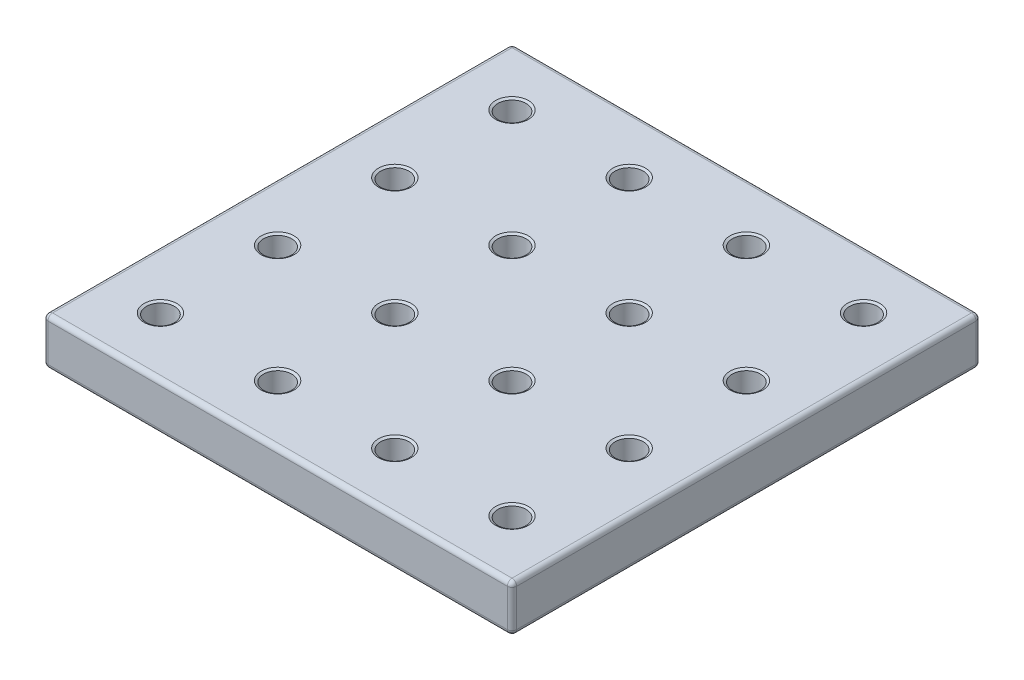
from build123d import *
from OCP.BRepFilletAPI import BRepFilletAPI_MakeChamfer

# Parameters (mm, degrees)
BASE_SKETCH_W          = 50
BASE_SKETCH_H          = 50
BASE_EXTRUDE_DEPTH     = 5
CIRCLES_SKETCH_R       = 1.5
CIRCLE_CUTS_DEPTH      = 5
EDGE_FILLET_R          = 0.5
CIRCULAR_CHAMFER_SIZE  = 0.25
CIRCULAR_CHAMFER_SIZE2 = 0.144337567


with BuildPart() as part:
    # Base Sketch → Base Extrude (new body)
    with BuildSketch(Plane(origin=(0, 0, 0), x_dir=(1, 0, 0), z_dir=(0, 1, 0))):
        Rectangle(BASE_SKETCH_W, BASE_SKETCH_H)
    extrude(amount=BASE_EXTRUDE_DEPTH)

    # Circles Sketch → Circle Cuts (cut)
    with BuildSketch(Plane(origin=(0, 5, 0), x_dir=(1, 0, 0), z_dir=(0, 1, 0))):
        with Locations(Location((-18.75, 18.75, 0), (0, 0, 270))):
            Circle(CIRCLES_SKETCH_R)
        with Locations(Location((-6.25, 18.75, 0), (0, 0, 270))):
            Circle(CIRCLES_SKETCH_R)
        with Locations(Location((6.25, 18.75, 0), (0, 0, 270))):
            Circle(CIRCLES_SKETCH_R)
        with Locations(Location((18.75, 18.75, 0), (0, 0, 270))):
            Circle(CIRCLES_SKETCH_R)
        with Locations(Location((-18.75, 6.25, 0), (0, 0, 270))):
            Circle(CIRCLES_SKETCH_R)
        with Locations(Location((-6.25, 6.25, 0), (0, 0, 270))):
            Circle(CIRCLES_SKETCH_R)
        with Locations(Location((6.25, 6.25, 0), (0, 0, 270))):
            Circle(CIRCLES_SKETCH_R)
        with Locations(Location((18.75, 6.25, 0), (0, 0, 270))):
            Circle(CIRCLES_SKETCH_R)
        with Locations(Location((-18.75, -6.25, 0), (0, 0, 270))):
            Circle(CIRCLES_SKETCH_R)
        with Locations(Location((-6.25, -6.25, 0), (0, 0, 270))):
            Circle(CIRCLES_SKETCH_R)
        with Locations(Location((6.25, -6.25, 0), (0, 0, 270))):
            Circle(CIRCLES_SKETCH_R)
        with Locations(Location((18.75, -6.25, 0), (0, 0, 270))):
            Circle(CIRCLES_SKETCH_R)
        with Locations(Location((-18.75, -18.75, 0), (0, 0, 270))):
            Circle(CIRCLES_SKETCH_R)
        with Locations(Location((-6.25, -18.75, 0), (0, 0, 270))):
            Circle(CIRCLES_SKETCH_R)
        with Locations(Location((6.25, -18.75, 0), (0, 0, 270))):
            Circle(CIRCLES_SKETCH_R)
        with Locations(Location((18.75, -18.75, 0), (0, 0, 270))):
            Circle(CIRCLES_SKETCH_R)
    extrude(amount=-CIRCLE_CUTS_DEPTH, mode=Mode.SUBTRACT)

    # Edge Fillet
    edge_fillet_edges = [part.edges().sort_by_distance(p)[0] for p in [
        (-25, 5, 0),
        (0, 5, 25),
        (25, 5, 0),
        (0, 0, 25),
        (-25, 0, 0),
        (0, 0, -25),
        (25, 0, 0),
        (25, 2.5, 25),
        (-25, 2.5, 25),
        (-25, 2.5, -25),
        (25, 2.5, -25),
        (0, 5, -25),
    ]]
    fillet(edge_fillet_edges, radius=EDGE_FILLET_R)

    # Circular Chamfer: one chamfer whose edges measure the first distance from different faces: ONE call of the kernel's chamfer builder (chamfer() names one face for all edges)
    circular_chamfer_edges_1 = [part.edges().sort_by_distance(p)[0] for p in [
        (18.75, 0, -20.25),
    ]]
    circular_chamfer_side_1 = [part.faces().sort_by_distance(p)[0] for p in [
        (18.75, 2.5, -20.25),
    ]]
    circular_chamfer_edges_2 = [part.edges().sort_by_distance(p)[0] for p in [
        (18.75, 5, -20.25),
        (6.25, 5, -20.25),
        (6.25, 5, -7.75),
        (6.25, 5, 4.75),
        (-6.25, 5, 4.75),
        (-6.25, 5, -7.75),
        (-6.25, 5, -20.25),
        (-18.75, 5, -20.25),
        (-18.75, 5, 17.25),
        (-6.25, 5, 17.25),
        (6.25, 5, 17.25),
        (18.75, 5, 4.75),
        (18.75, 5, 17.25),
        (-18.75, 5, 4.75),
        (-18.75, 5, -7.75),
        (18.75, 5, -7.75),
    ]]
    circular_chamfer_side_2 = [part.faces().sort_by_distance(p)[0] for p in [
        (0, 5, 0),
    ]]
    circular_chamfer_edges_3 = [part.edges().sort_by_distance(p)[0] for p in [
        (6.25, 0, -20.25),
    ]]
    circular_chamfer_side_3 = [part.faces().sort_by_distance(p)[0] for p in [
        (6.25, 2.5, -20.25),
    ]]
    circular_chamfer_edges_4 = [part.edges().sort_by_distance(p)[0] for p in [
        (6.25, 0, -7.75),
    ]]
    circular_chamfer_side_4 = [part.faces().sort_by_distance(p)[0] for p in [
        (6.25, 2.5, -7.75),
    ]]
    circular_chamfer_edges_5 = [part.edges().sort_by_distance(p)[0] for p in [
        (6.25, 0, 4.75),
    ]]
    circular_chamfer_side_5 = [part.faces().sort_by_distance(p)[0] for p in [
        (6.25, 2.5, 4.75),
    ]]
    circular_chamfer_edges_6 = [part.edges().sort_by_distance(p)[0] for p in [
        (-6.25, 0, 4.75),
    ]]
    circular_chamfer_side_6 = [part.faces().sort_by_distance(p)[0] for p in [
        (-6.25, 2.5, 4.75),
    ]]
    circular_chamfer_edges_7 = [part.edges().sort_by_distance(p)[0] for p in [
        (-6.25, 0, -7.75),
    ]]
    circular_chamfer_side_7 = [part.faces().sort_by_distance(p)[0] for p in [
        (-6.25, 2.5, -7.75),
    ]]
    circular_chamfer_edges_8 = [part.edges().sort_by_distance(p)[0] for p in [
        (-6.25, 0, -20.25),
    ]]
    circular_chamfer_side_8 = [part.faces().sort_by_distance(p)[0] for p in [
        (-6.25, 2.5, -20.25),
    ]]
    circular_chamfer_edges_9 = [part.edges().sort_by_distance(p)[0] for p in [
        (-18.75, 0, -20.25),
    ]]
    circular_chamfer_side_9 = [part.faces().sort_by_distance(p)[0] for p in [
        (-18.75, 2.5, -20.25),
    ]]
    circular_chamfer_edges_10 = [part.edges().sort_by_distance(p)[0] for p in [
        (-18.75, 0, 17.25),
    ]]
    circular_chamfer_side_10 = [part.faces().sort_by_distance(p)[0] for p in [
        (-18.75, 2.5, 17.25),
    ]]
    circular_chamfer_edges_11 = [part.edges().sort_by_distance(p)[0] for p in [
        (-6.25, 0, 17.25),
    ]]
    circular_chamfer_side_11 = [part.faces().sort_by_distance(p)[0] for p in [
        (-6.25, 2.5, 17.25),
    ]]
    circular_chamfer_edges_12 = [part.edges().sort_by_distance(p)[0] for p in [
        (6.25, 0, 17.25),
    ]]
    circular_chamfer_side_12 = [part.faces().sort_by_distance(p)[0] for p in [
        (6.25, 2.5, 17.25),
    ]]
    circular_chamfer_edges_13 = [part.edges().sort_by_distance(p)[0] for p in [
        (18.75, 0, 4.75),
    ]]
    circular_chamfer_side_13 = [part.faces().sort_by_distance(p)[0] for p in [
        (18.75, 2.5, 4.75),
    ]]
    circular_chamfer_edges_14 = [part.edges().sort_by_distance(p)[0] for p in [
        (18.75, 0, 17.25),
    ]]
    circular_chamfer_side_14 = [part.faces().sort_by_distance(p)[0] for p in [
        (18.75, 2.5, 17.25),
    ]]
    circular_chamfer_edges_15 = [part.edges().sort_by_distance(p)[0] for p in [
        (-18.75, 0, 4.75),
    ]]
    circular_chamfer_side_15 = [part.faces().sort_by_distance(p)[0] for p in [
        (-18.75, 2.5, 4.75),
    ]]
    circular_chamfer_edges_16 = [part.edges().sort_by_distance(p)[0] for p in [
        (-18.75, 0, -7.75),
    ]]
    circular_chamfer_side_16 = [part.faces().sort_by_distance(p)[0] for p in [
        (-18.75, 2.5, -7.75),
    ]]
    circular_chamfer_edges_17 = [part.edges().sort_by_distance(p)[0] for p in [
        (18.75, 0, -7.75),
    ]]
    circular_chamfer_side_17 = [part.faces().sort_by_distance(p)[0] for p in [
        (18.75, 2.5, -7.75),
    ]]
    circular_chamfer = BRepFilletAPI_MakeChamfer(part.part.solid().wrapped)
    for e in circular_chamfer_edges_1:
        circular_chamfer.Add(CIRCULAR_CHAMFER_SIZE, CIRCULAR_CHAMFER_SIZE2, e.wrapped, circular_chamfer_side_1[0].wrapped)  # the first distance lies on this face
    for e in circular_chamfer_edges_2:
        circular_chamfer.Add(CIRCULAR_CHAMFER_SIZE, CIRCULAR_CHAMFER_SIZE2, e.wrapped, circular_chamfer_side_2[0].wrapped)  # the first distance lies on this face
    for e in circular_chamfer_edges_3:
        circular_chamfer.Add(CIRCULAR_CHAMFER_SIZE, CIRCULAR_CHAMFER_SIZE2, e.wrapped, circular_chamfer_side_3[0].wrapped)  # the first distance lies on this face
    for e in circular_chamfer_edges_4:
        circular_chamfer.Add(CIRCULAR_CHAMFER_SIZE, CIRCULAR_CHAMFER_SIZE2, e.wrapped, circular_chamfer_side_4[0].wrapped)  # the first distance lies on this face
    for e in circular_chamfer_edges_5:
        circular_chamfer.Add(CIRCULAR_CHAMFER_SIZE, CIRCULAR_CHAMFER_SIZE2, e.wrapped, circular_chamfer_side_5[0].wrapped)  # the first distance lies on this face
    for e in circular_chamfer_edges_6:
        circular_chamfer.Add(CIRCULAR_CHAMFER_SIZE, CIRCULAR_CHAMFER_SIZE2, e.wrapped, circular_chamfer_side_6[0].wrapped)  # the first distance lies on this face
    for e in circular_chamfer_edges_7:
        circular_chamfer.Add(CIRCULAR_CHAMFER_SIZE, CIRCULAR_CHAMFER_SIZE2, e.wrapped, circular_chamfer_side_7[0].wrapped)  # the first distance lies on this face
    for e in circular_chamfer_edges_8:
        circular_chamfer.Add(CIRCULAR_CHAMFER_SIZE, CIRCULAR_CHAMFER_SIZE2, e.wrapped, circular_chamfer_side_8[0].wrapped)  # the first distance lies on this face
    for e in circular_chamfer_edges_9:
        circular_chamfer.Add(CIRCULAR_CHAMFER_SIZE, CIRCULAR_CHAMFER_SIZE2, e.wrapped, circular_chamfer_side_9[0].wrapped)  # the first distance lies on this face
    for e in circular_chamfer_edges_10:
        circular_chamfer.Add(CIRCULAR_CHAMFER_SIZE, CIRCULAR_CHAMFER_SIZE2, e.wrapped, circular_chamfer_side_10[0].wrapped)  # the first distance lies on this face
    for e in circular_chamfer_edges_11:
        circular_chamfer.Add(CIRCULAR_CHAMFER_SIZE, CIRCULAR_CHAMFER_SIZE2, e.wrapped, circular_chamfer_side_11[0].wrapped)  # the first distance lies on this face
    for e in circular_chamfer_edges_12:
        circular_chamfer.Add(CIRCULAR_CHAMFER_SIZE, CIRCULAR_CHAMFER_SIZE2, e.wrapped, circular_chamfer_side_12[0].wrapped)  # the first distance lies on this face
    for e in circular_chamfer_edges_13:
        circular_chamfer.Add(CIRCULAR_CHAMFER_SIZE, CIRCULAR_CHAMFER_SIZE2, e.wrapped, circular_chamfer_side_13[0].wrapped)  # the first distance lies on this face
    for e in circular_chamfer_edges_14:
        circular_chamfer.Add(CIRCULAR_CHAMFER_SIZE, CIRCULAR_CHAMFER_SIZE2, e.wrapped, circular_chamfer_side_14[0].wrapped)  # the first distance lies on this face
    for e in circular_chamfer_edges_15:
        circular_chamfer.Add(CIRCULAR_CHAMFER_SIZE, CIRCULAR_CHAMFER_SIZE2, e.wrapped, circular_chamfer_side_15[0].wrapped)  # the first distance lies on this face
    for e in circular_chamfer_edges_16:
        circular_chamfer.Add(CIRCULAR_CHAMFER_SIZE, CIRCULAR_CHAMFER_SIZE2, e.wrapped, circular_chamfer_side_16[0].wrapped)  # the first distance lies on this face
    for e in circular_chamfer_edges_17:
        circular_chamfer.Add(CIRCULAR_CHAMFER_SIZE, CIRCULAR_CHAMFER_SIZE2, e.wrapped, circular_chamfer_side_17[0].wrapped)  # the first distance lies on this face
    add(Compound.cast(circular_chamfer.Shape()), mode=Mode.REPLACE)


solid = part.part
